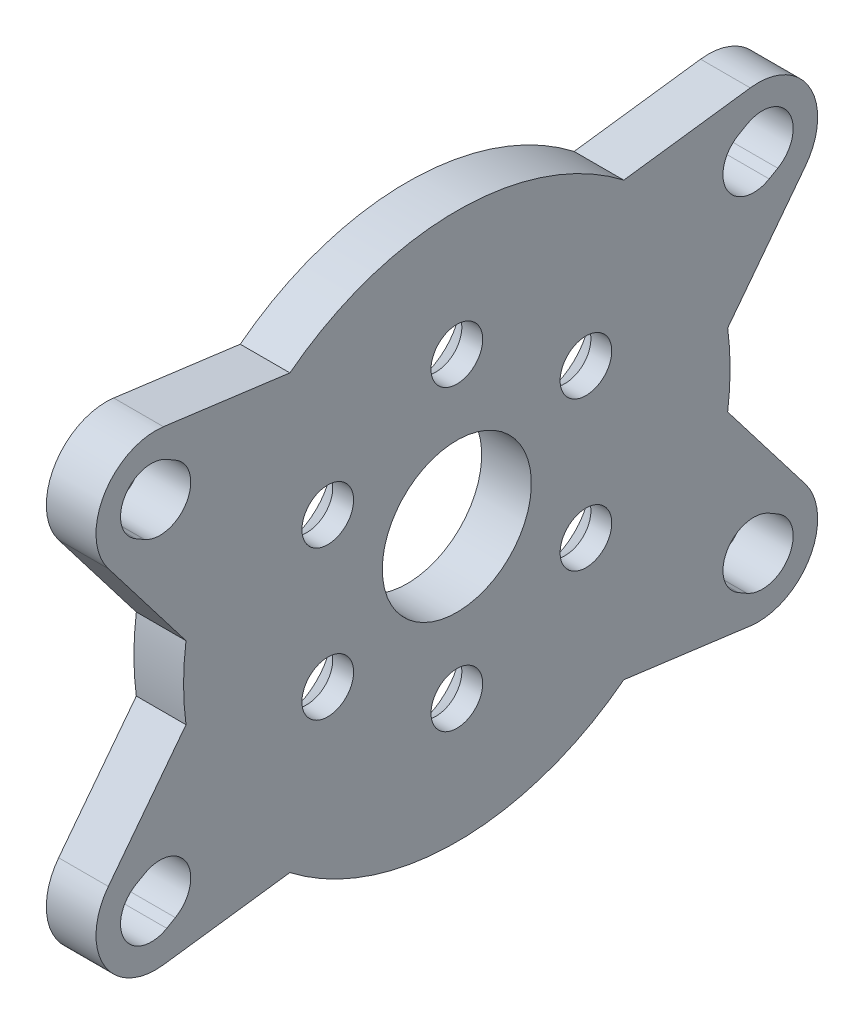
from build123d import *
from build123d.topology import SkipClean

# Parameters (mm, degrees)
SKETCH_1_W                 = 5
SKETCH_1_H                 = 20
EXTRUDE_START              = -5
EXTRUDE_1_DEPTH            = 5
PATTERN_CIRCULAR_3_COUNT   = 3
PATTERN_CIRCULAR_3_ANGLE   = 120
F_3_THE_OTHER_WAY_COUNT    = 3
F_3_THE_OTHER_WAY_ANGLE    = 120
CUT_EXTRUDE_3_DEPTH        = 55.995278612
PATTERN_CIRCULAR_2_COUNT   = 3
PATTERN_CIRCULAR_2_ANGLE   = 120
F_2_THE_OTHER_WAY_COUNT    = 3
F_2_THE_OTHER_WAY_ANGLE    = 120
HOLE_WIZARD_M51_AT_2_COUNT = 2
HOLE_WIZARD_M51_AT_2_PITCH = 15
HOLE_WIZARD_M51_AT_3_COUNT = 2
HOLE_WIZARD_M51_AT_3_PITCH = 25.980762114
HOLE_WIZARD_M51_AT_4_COUNT = 2
HOLE_WIZARD_M51_AT_4_PITCH = 30
HOLE_WIZARD_M51_AT_5_COUNT = 2
HOLE_WIZARD_M51_AT_5_PITCH = 25.980762114
HOLE_WIZARD_M51_AT_6_COUNT = 2
HOLE_WIZARD_M51_AT_6_PITCH = 15
CUT_EXTRUDE_4_DEPTH        = 55.995278612


with BuildPart() as part:
    # Эскиз1 → Повернуть1 (revolve)
    with BuildSketch(Plane.XY, mode=Mode.PRIVATE) as revolve_1_sk:
        with Locations((2.5, 17.5)):
            Rectangle(SKETCH_1_W, SKETCH_1_H)
    revolve(revolve_1_sk.sketch.rotate(Axis((-29.36512031, 0, 0), (1, 0, 0)), 90), axis=Axis((-29.36512031, 0, 0), (1, 0, 0)))

    # Эскиз11 → Бобышка-Вытянуть1 (add)
    with BuildSketch(Plane.ZY.offset(EXTRUDE_START)):
        with BuildLine():
            Line((-5.543277195, 37.296100594), (-10.456537126, 25.434441832))
            ThreePointArc((-10.456537126, 25.434441832), (0, 27.5), (10.456537126, 25.434441832))
            Line((10.456537126, 25.434441832), (5.543277195, 37.296100594))
            ThreePointArc((5.543277195, 37.296100594), (0, 41), (-5.543277195, 37.296100594))
        make_face()
    extrude_1 = extrude(amount=EXTRUDE_1_DEPTH)

    # Круговой массив3: Бобышка-Вытянуть1 ×3 about axis
    pattern_circular_3_axis = Axis((0, 0, 0), (-1, 0, 0))
    for i in range(1, PATTERN_CIRCULAR_3_COUNT):
        add(extrude_1.rotate(pattern_circular_3_axis, i * PATTERN_CIRCULAR_3_ANGLE / (PATTERN_CIRCULAR_3_COUNT - 1)))

    # 3 the other way: Бобышка-Вытянуть1 ×3 about axis
    f_3_the_other_way_axis = Axis((0, 0, 0), (1, 0, 0))
    for i in range(1, F_3_THE_OTHER_WAY_COUNT):
        add(extrude_1.rotate(f_3_the_other_way_axis, i * F_3_THE_OTHER_WAY_ANGLE / (F_3_THE_OTHER_WAY_COUNT - 1)))

    # Эскиз6 → Вырез-Вытянуть3 (cut, symmetric)
    with BuildSketch(Plane.ZY):
        with BuildLine():
            Line((-3.1, 35.5), (-3.1, 34.5))
            ThreePointArc((-3.1, 34.5), (0, 31.4), (3.1, 34.5))
            Line((3.1, 34.5), (3.1, 35.5))
            ThreePointArc((3.1, 35.5), (0, 38.6), (-3.1, 35.5))
        make_face()
    cut_extrude_3 = extrude(amount=CUT_EXTRUDE_3_DEPTH, both=True, mode=Mode.SUBTRACT)

    # Круговой массив2: Вырез-Вытянуть3 ×3 about axis
    pattern_circular_2_axis = Axis((0, 0, 0), (-1, 0, 0))
    for i in range(1, PATTERN_CIRCULAR_2_COUNT):
        add(cut_extrude_3.rotate(pattern_circular_2_axis, i * PATTERN_CIRCULAR_2_ANGLE / (PATTERN_CIRCULAR_2_COUNT - 1)), mode=Mode.SUBTRACT)

    # 2 the other way: Вырез-Вытянуть3 ×3 about axis
    f_2_the_other_way_axis = Axis((0, 0, 0), (1, 0, 0))
    for i in range(1, F_2_THE_OTHER_WAY_COUNT):
        add(cut_extrude_3.rotate(f_2_the_other_way_axis, i * F_2_THE_OTHER_WAY_ANGLE / (F_2_THE_OTHER_WAY_COUNT - 1)), mode=Mode.SUBTRACT)

    # Эскиз10 → Зенковка для винта с потайной головкой и внутренним шестигранником M51 (revolve, cut)
    with BuildSketch(Plane.ZX.offset(15)):
        Polygon((0, 0), (0, 5), (2.6, 5), (2.6, 2.9), (5.5, 0), align=None)
    hole_wizard_m51 = revolve(axis=Axis((-6.35, 15, 0), (1, 0, 0)), mode=Mode.SUBTRACT)

    # Зенковка для винта с потайной головкой и внутренним шестигранником M51 at 2: Зенковка для винта с потайной головкой и внутренним шестигранником M51 ×2
    with Locations(*[Vector(0, -0.4999999999999632, 0.8660254037844599) * (i * HOLE_WIZARD_M51_AT_2_PITCH) for i in range(1, HOLE_WIZARD_M51_AT_2_COUNT)]):
        add(hole_wizard_m51, mode=Mode.SUBTRACT)

    # Зенковка для винта с потайной головкой и внутренним шестигранником M51 at 3: Зенковка для винта с потайной головкой и внутренним шестигранником M51 ×2
    with Locations(*[Vector(0, -0.8660254037844174, 0.5000000000000369) * (i * HOLE_WIZARD_M51_AT_3_PITCH) for i in range(1, HOLE_WIZARD_M51_AT_3_COUNT)]):
        add(hole_wizard_m51, mode=Mode.SUBTRACT)

    # Зенковка для винта с потайной головкой и внутренним шестигранником M51 at 4: Зенковка для винта с потайной головкой и внутренним шестигранником M51 ×2
    with Locations(*[(0, -i * HOLE_WIZARD_M51_AT_4_PITCH, 0) for i in range(1, HOLE_WIZARD_M51_AT_4_COUNT)]):
        add(hole_wizard_m51, mode=Mode.SUBTRACT)

    # Зенковка для винта с потайной головкой и внутренним шестигранником M51 at 5: Зенковка для винта с потайной головкой и внутренним шестигранником M51 ×2
    with Locations(*[Vector(0, -0.8660254037844599, -0.49999999999996314) * (i * HOLE_WIZARD_M51_AT_5_PITCH) for i in range(1, HOLE_WIZARD_M51_AT_5_COUNT)]):
        add(hole_wizard_m51, mode=Mode.SUBTRACT)

    # Зенковка для винта с потайной головкой и внутренним шестигранником M51 at 6: Зенковка для винта с потайной головкой и внутренним шестигранником M51 ×2
    with Locations(*[Vector(0, -0.5000000000000366, -0.8660254037844176) * (i * HOLE_WIZARD_M51_AT_6_PITCH) for i in range(1, HOLE_WIZARD_M51_AT_6_COUNT)]):
        add(hole_wizard_m51, mode=Mode.SUBTRACT)

    # Эскиз12 → Вырез-Вытянуть4 (cut, through all)
    with SkipClean():  # the faces are left unmerged after this step: merging them gives an invalid solid
        with BuildSketch(Plane.ZY):
            with BuildLine():
                Line((10.456537126, 25.434441832), (5.543277195, 37.296100594))
                ThreePointArc((5.543277195, 37.296100594), (0, 41), (-5.543277195, 37.296100594))
                Line((-5.543277195, 37.296100594), (-10.456537126, 25.434441832))
                ThreePointArc((-10.456537126, 25.434441832), (0, 27.5), (10.456537126, 25.434441832))
            make_face()
        extrude(amount=-CUT_EXTRUDE_4_DEPTH, mode=Mode.SUBTRACT)


solid = part.part
